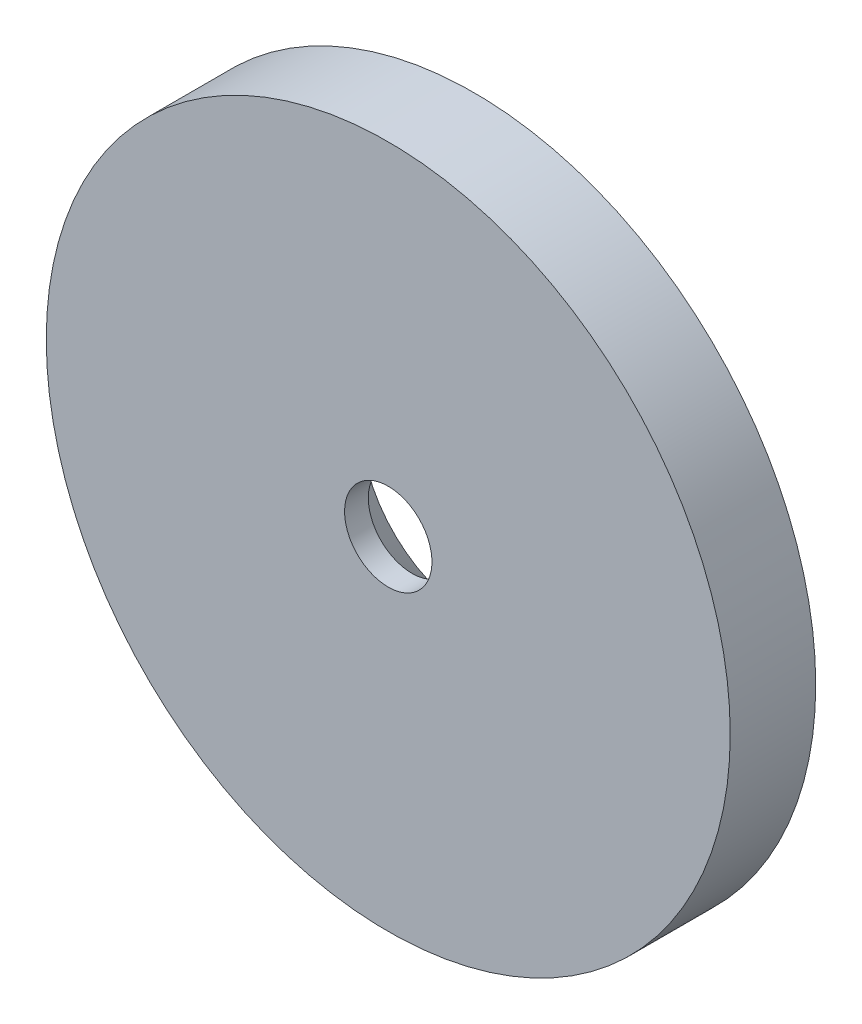
from build123d import *

# Parameters (mm, degrees)
SKETCH1_R           = 9.144
BOSS_EXTRUDE1_DEPTH = 2.286


with BuildPart() as part:
    # Sketch1 → Boss-Extrude1 (new body)
    with BuildSketch(Plane.XY):
        Circle(SKETCH1_R)
    extrude(amount=BOSS_EXTRUDE1_DEPTH)

    # Sketch7 → CBORE for #1 Binding Head Machine Screw2 (revolve, cut)
    with BuildSketch(Plane.YZ):
        Polygon((0, 0), (0, 2.286), (1.1684, 2.286), (1.1684, 1.651), (1.651, 1.651), (1.651, 1.36525), (3.01625, 0), align=None)
    revolve(axis=Axis((0, 0, -6.35), (0, 0, 1)), mode=Mode.SUBTRACT)


solid = part.part
